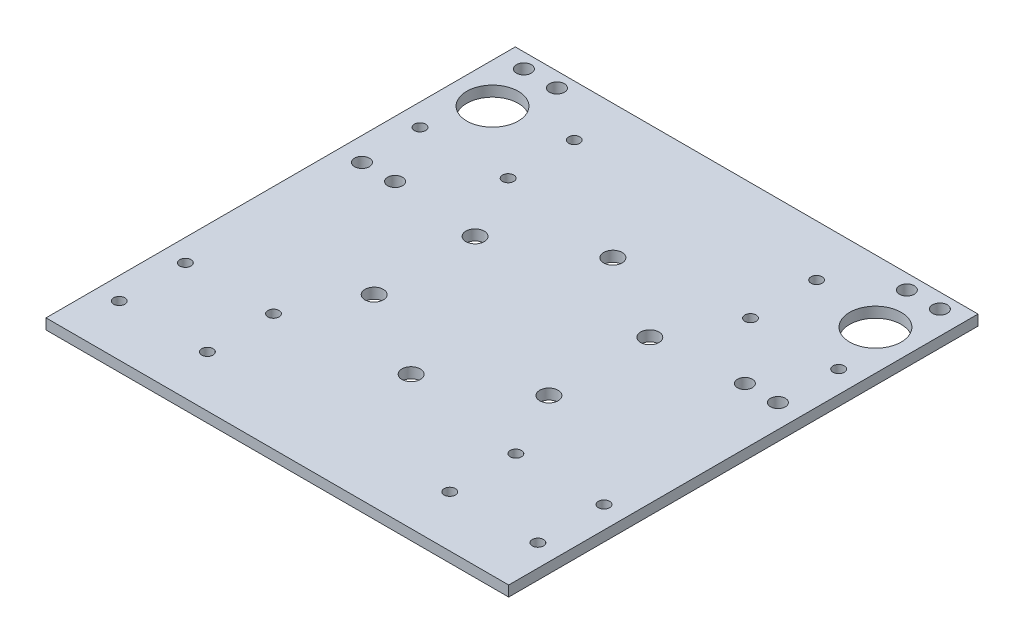
from build123d import *

# Parameters (mm, degrees)
SKETCH1_W           = 140
SKETCH1_H           = 142
BOSS_EXTRUDE1_DEPTH = 3.175
SKETCH2_R           = 7.8
SKETCH2_R_2         = 2.25
SKETCH2_R_3         = 1.7
CUT_EXTRUDE1_DEPTH  = 3.175
SKETCH4_R           = 2.778125
CUT_EXTRUDE2_DEPTH  = 3.175


with BuildPart() as part:
    # Sketch1 → Boss-Extrude1 (new body)
    with BuildSketch(Plane(origin=(0, 0, 0), x_dir=(1, 0, 0), z_dir=(0, 1, 0))):
        Rectangle(SKETCH1_W, SKETCH1_H)
    extrude(amount=BOSS_EXTRUDE1_DEPTH)

    # Sketch2 → Cut-Extrude1 (cut)
    with BuildSketch(Plane(origin=(0, 3.175, 0), x_dir=(1, 0, 0), z_dir=(0, 1, 0))):
        with Locations(Location((-57.9286, 52.0357, 0), (0, 0, 270))):
            Circle(SKETCH2_R)
        with Locations(Location((-62.9286, 66.5357, 0), (0, 0, 270))):
            Circle(SKETCH2_R_2)
        with Locations(Location((-52.9286, 66.5357, 0), (0, 0, 90))):
            Circle(SKETCH2_R_2)
        with Locations(Location((-52.9286, 17.5357, 0), (0, 0, 270))):
            Circle(SKETCH2_R_2)
        with Locations(Location((-62.9286, 17.5357, 0), (0, 0, 90))):
            Circle(SKETCH2_R_2)
        with Locations(Location((52.9286, 17.5357, 0), (0, 0, 90))):
            Circle(SKETCH2_R_2)
        with Locations(Location((62.9286, 17.5357, 0), (0, 0, 270))):
            Circle(SKETCH2_R_2)
        with Locations(Location((57.9286, 52.0357, 0), (0, 0, 90))):
            Circle(SKETCH2_R)
        with Locations(Location((52.9286, 66.5357, 0), (0, 0, 270))):
            Circle(SKETCH2_R_2)
        with Locations(Location((62.9286, 66.5357, 0), (0, 0, 90))):
            Circle(SKETCH2_R_2)
        with Locations(Location((-36.666666667, 55.5, 0), (0, 0, 270))):
            Circle(SKETCH2_R_3)
        with Locations(Location((-36.666666667, 35.5, 0), (0, 0, 90))):
            Circle(SKETCH2_R_3)
        with Locations(Location((-63.333333333, 35.5, 0), (0, 0, 270))):
            Circle(SKETCH2_R_3)
        with Locations(Location((36.666666667, 35.5, 0), (0, 0, 270))):
            Circle(SKETCH2_R_3)
        with Locations(Location((63.333333333, 35.5, 0), (0, 0, 90))):
            Circle(SKETCH2_R_3)
        with Locations(Location((36.666666667, 55.5, 0), (0, 0, 90))):
            Circle(SKETCH2_R_3)
        with Locations(Location((63.333333333, -35.5, 0), (0, 0, 270))):
            Circle(SKETCH2_R_3)
        with Locations(Location((36.666666667, -35.5, 0), (0, 0, 90))):
            Circle(SKETCH2_R_3)
        with Locations(Location((63.333333333, -55.5, 0), (0, 0, 90))):
            Circle(SKETCH2_R_3)
        with Locations(Location((36.666666667, -55.5, 0), (0, 0, 270))):
            Circle(SKETCH2_R_3)
        with Locations(Location((-36.666666667, -35.5, 0), (0, 0, 270))):
            Circle(SKETCH2_R_3)
        with Locations(Location((-63.333333333, -35.5, 0), (0, 0, 90))):
            Circle(SKETCH2_R_3)
        with Locations(Location((-36.666666667, -55.5, 0), (0, 0, 90))):
            Circle(SKETCH2_R_3)
        with Locations(Location((-63.333333333, -55.5, 0), (0, 0, 270))):
            Circle(SKETCH2_R_3)
    extrude(amount=-CUT_EXTRUDE1_DEPTH, mode=Mode.SUBTRACT)

    # Sketch4 → Cut-Extrude2 (cut)
    with BuildSketch(Plane(origin=(0, 3.175, 0), x_dir=(1, 0, 0), z_dir=(0, 1, 0))):
        with Locations(Location((0, 30.525, 0), (0, 0, 270))):
            Circle(SKETCH4_R)
        with Locations(Location((26.435425451, 15.2625, 0), (0, 0, 270))):
            Circle(SKETCH4_R)
        with Locations(Location((26.435425451, -15.2625, 0), (0, 0, 270))):
            Circle(SKETCH4_R)
        with Locations(Location((0, -30.525, 0), (0, 0, 270))):
            Circle(SKETCH4_R)
        with Locations(Location((-26.435425451, -15.2625, 0), (0, 0, 270))):
            Circle(SKETCH4_R)
        with Locations(Location((-26.435425451, 15.2625, 0), (0, 0, 270))):
            Circle(SKETCH4_R)
    extrude(amount=-CUT_EXTRUDE2_DEPTH, mode=Mode.SUBTRACT)


solid = part.part
